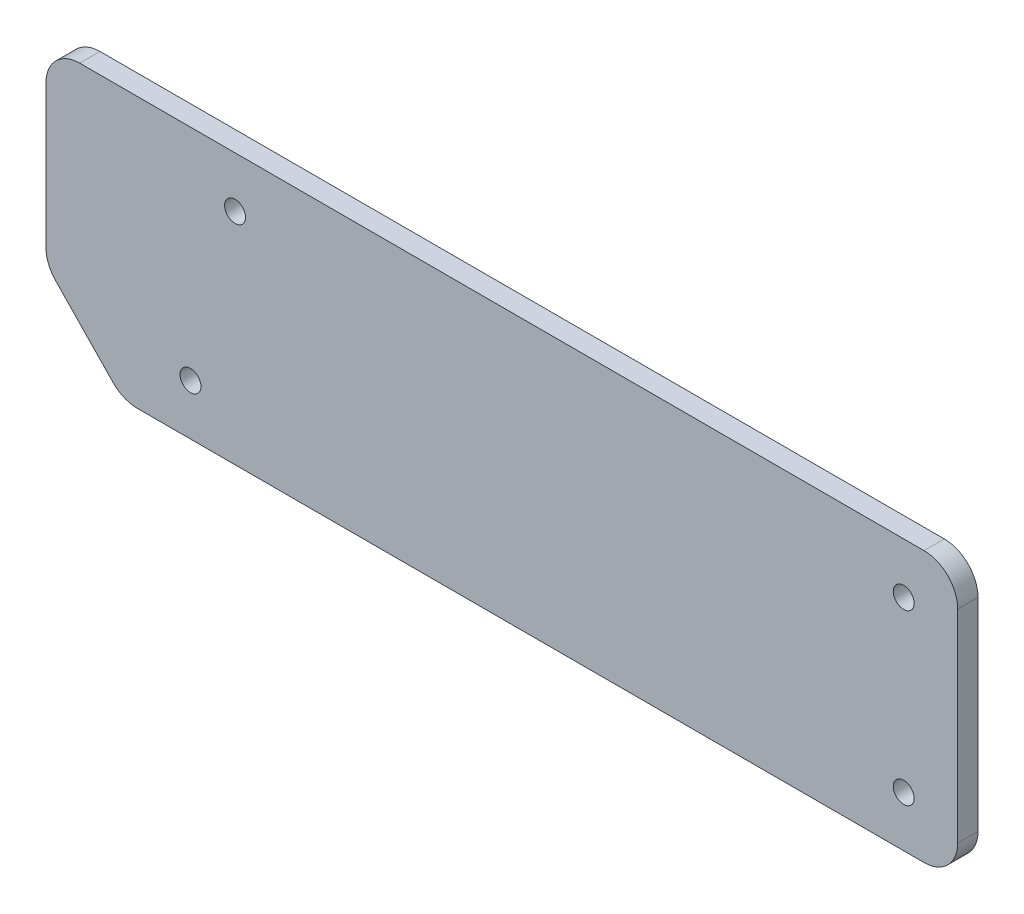
from build123d import *

# Parameters (mm, degrees)
SKETCH1_W           = 270
SKETCH1_H           = 80
BOSS_EXTRUDE1_DEPTH = 6
SKETCH2_R           = 3.1
CUT_EXTRUDE1_DEPTH  = 141.929060169
FILLET1_R           = 10
CUT_EXTRUDE2_DEPTH  = 10
FILLET2_R           = 10


with BuildPart() as part:
    # Sketch1 → Boss-Extrude1 (new body)
    with BuildSketch(Plane.XY):
        Rectangle(SKETCH1_W, SKETCH1_H)
    extrude(amount=BOSS_EXTRUDE1_DEPTH)

    # Sketch2 → Cut-Extrude1 (cut, through all)
    with BuildSketch(Plane.XY.offset(6)):
        with Locations((-79, 25)):
            Circle(SKETCH2_R)
        with Locations((119, 25)):
            Circle(SKETCH2_R)
        with Locations((119, -25)):
            Circle(SKETCH2_R)
        with Locations((-92.21, -25)):
            Circle(SKETCH2_R)
    extrude(amount=-CUT_EXTRUDE1_DEPTH, mode=Mode.SUBTRACT)

    # Fillet1
    fillet1_edges = [part.edges().sort_by_distance(p)[0] for p in [
        (135, -40, 3),
        (-135, -40, 3),
        (-135, 40, 3),
        (135, 40, 3),
    ]]
    fillet(fillet1_edges, radius=FILLET1_R)

    # Sketch3 → Cut-Extrude2 (cut)
    with BuildSketch(Plane.XY.offset(6)):
        Polygon((-112.21, -40), (-154.206287839, 3.47324229), (-156.168985045, -56.555388838), (-112.21, -57.992672605), align=None)
    extrude(amount=-CUT_EXTRUDE2_DEPTH, mode=Mode.SUBTRACT)

    # Fillet2
    fillet2_edges = [part.edges().sort_by_distance(p)[0] for p in [
        (-135, -16.408505543, 3),
        (-112.21, -40, 3),
    ]]
    fillet(fillet2_edges, radius=FILLET2_R)


solid = part.part
